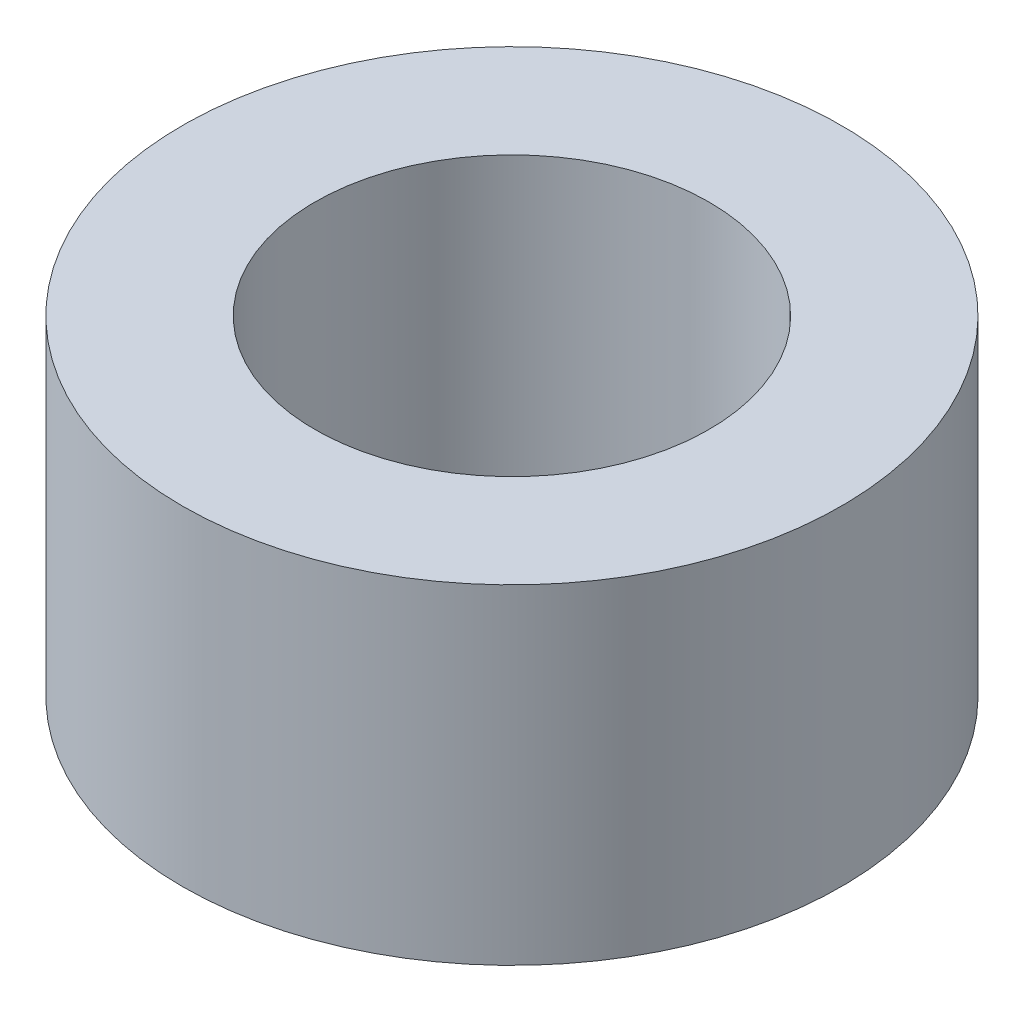
from build123d import *

# Parameters (mm, degrees)
SKETCH1_R             = 3.175
BOSS_EXTRUDE1_DEPTH   = 3.175
F_6_CLEARANCE_HOLE1_D = 3.7973


with BuildPart() as part:
    # Sketch1 → Boss-Extrude1 (new body)
    with BuildSketch(Plane(origin=(0, 0, 0), x_dir=(1, 0, 0), z_dir=(0, 1, 0))):
        with Locations(Location((0, 0, 0), (0, 0, 270))):
            Circle(SKETCH1_R)
    extrude(amount=BOSS_EXTRUDE1_DEPTH)

    # #6 Clearance Hole1 (through all)
    with Locations(Plane(origin=(0, 0, 0), x_dir=(0, 0, -1), z_dir=(0, -1, 0))):
        with Locations((0, 0)):
            Hole(F_6_CLEARANCE_HOLE1_D / 2)


solid = part.part
